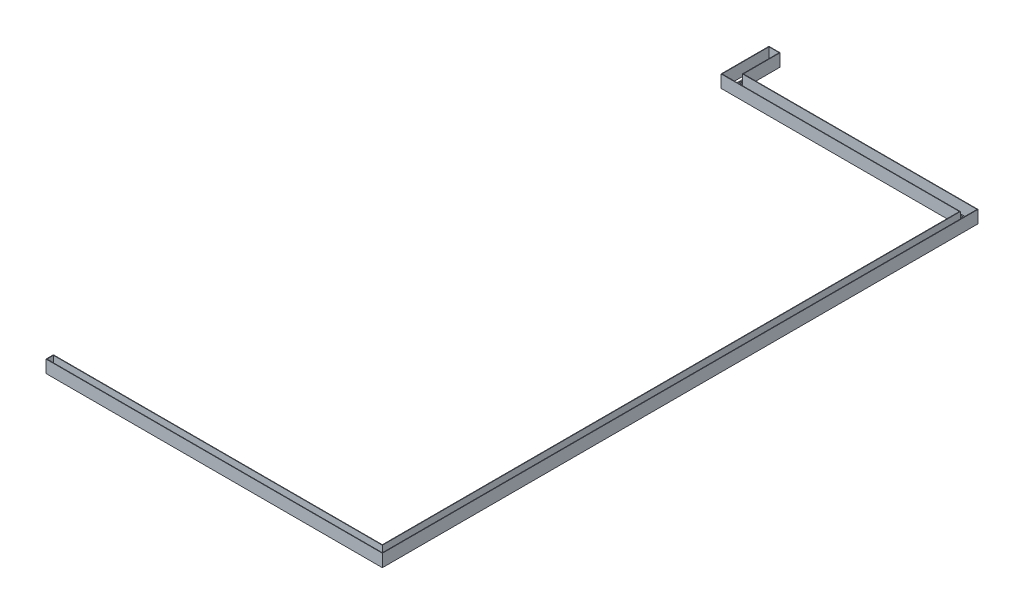
from build123d import *

# Parameters (mm, degrees)
SALIENTE_EXTRUIR1_DEPTH      = 150
SALIENTE_EXTRUIR1_DEPTH_BACK = 1200
CROQUIS3_R                   = 38.1
CROQUIS3_R_2                 = 34.511608593
CROQUIS3_R_3                 = 35.449075263
CROQUIS3_R_4                 = 32.088781466


with BuildPart() as part:
    # Croquis1 → Saliente-Extruir1 (new, two sides: drawn at the far end of the back side and taken through both)
    with BuildSketch(Plane(origin=(0, 0, 0), x_dir=(1, 0, 0), z_dir=(0, 1, 0)).offset(-SALIENTE_EXTRUIR1_DEPTH_BACK)):
        Polygon((-7150, 36825), (-7150, 32875), (18100, 32875), (18100, -31225), (-18100, -31225), (-18100, -30425), (17300, -30425), (17300, 31675), (-8350, 31675), (-8350, 36825), align=None)
        Polygon((18050, 32825), (18050, -31175), (-18050, -31175), (-18050, -30475), (17350, -30475), (17350, 31725), (-8300, 31725), (-8300, 36775), (-7200, 36775), (-7200, 32825), align=None, mode=Mode.SUBTRACT)
    extrude(amount=SALIENTE_EXTRUIR1_DEPTH + SALIENTE_EXTRUIR1_DEPTH_BACK)

    # Barrer2: sweep along a curve in space
    with BuildLine() as barrer2_path:
        Line((-7621.153153473, -862.5, -36825), (-7621.153153473, -862.5, -32583.554445635))
        ThreePointArc((-7621.153153473, -862.5, -32583.554445635), (-7503.995865948, -862.5, -32300.71173316), (-7221.153153473, -862.5, -32183.554445635))
        Line((-7221.153153473, -862.5, -32183.554445635), (17187.374912219, -862.5, -32183.554445635))
        ThreePointArc((17187.374912219, -862.5, -32183.554445635), (17470.217624693, -862.5, -32066.39715811), (17587.374912219, -862.5, -31783.554445635))
        Line((17587.374912219, -862.5, -31783.554445635), (17587.374912219, -862.5, 30292.314123157))
        ThreePointArc((17587.374912219, -862.5, 30292.314123157), (17470.217624693, -862.5, 30575.156835631), (17187.374912219, -862.5, 30692.314123157))
        Line((17187.374912219, -862.5, 30692.314123157), (-18047.242394096, -862.5, 30692.314123157))
    # Croquis3 → Barrer2 (sweep)
    # profile 1 of 3: a face of its own
    with BuildSketch(Plane(origin=(0, 0, -36825), x_dir=(-1, 0, 0), z_dir=(0, 0, -1))):
        with Locations((7479.923997875, -862.5)):
            Circle(CROQUIS3_R)
        with Locations((7479.923997875, -862.5)):
            Circle(CROQUIS3_R_2, mode=Mode.SUBTRACT)
    # profile 2 of 3: a face of its own
    with BuildSketch(Plane(origin=(0, 0, -36825), x_dir=(-1, 0, 0), z_dir=(0, 0, -1))):
        with Locations((7333.151050513, -862.5)):
            Circle(CROQUIS3_R)
        with Locations((7333.151050513, -862.5)):
            Circle(CROQUIS3_R_3, mode=Mode.SUBTRACT)
    # profile 3 of 3: a face of its own
    with BuildSketch(Plane(origin=(0, 0, -36825), x_dir=(-1, 0, 0), z_dir=(0, 0, -1))):
        with Locations((7635.921716819, -862.5)):
            Circle(CROQUIS3_R)
        with Locations((7635.921716819, -862.5)):
            Circle(CROQUIS3_R_4, mode=Mode.SUBTRACT)
    sweep(path=barrer2_path.line)


solid = part.part
